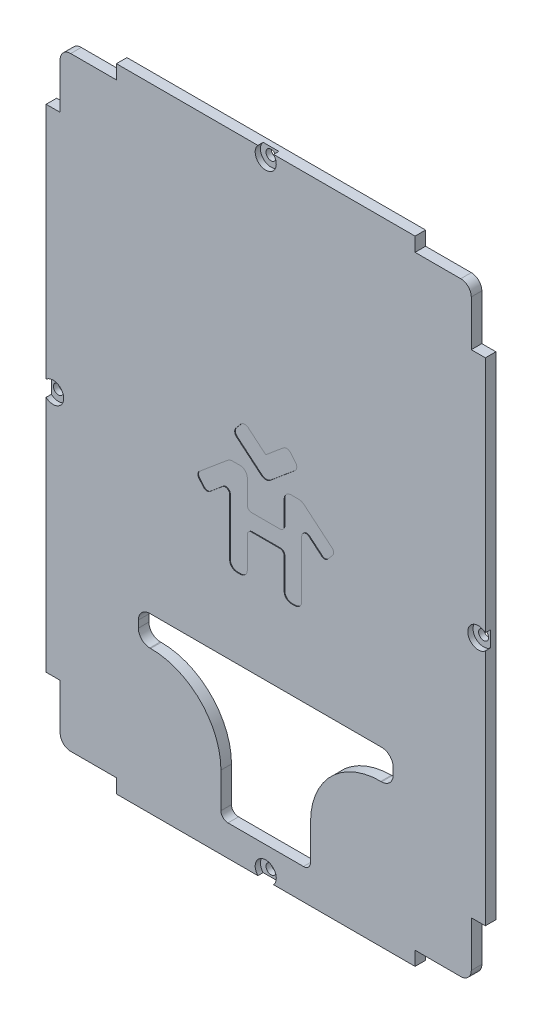
from build123d import *

# Parameters (mm, degrees)
EXTRUDE_1_DEPTH     = 3
CUT_EXTRUDE_1_DEPTH = 10
SKETCH_3_R          = 3
CUT_EXTRUDE_2_DEPTH = 1.5
SKETCH_4_R          = 1.425
CUT_EXTRUDE_3_DEPTH = 2
CUT_EXTRUDE_4_DEPTH = 0.2
CUT_EXTRUDE_START   = -10
CUT_EXTRUDE_5_DEPTH = 10


with BuildPart() as part:
    # Эскиз1 → Бобышка-Вытянуть1 (new body)
    with BuildSketch(Plane.XY):
        with BuildLine():
            Line((-52.5, -90), (52.5, -90))
            ThreePointArc((52.5, -90), (59.571067812, -87.071067812), (62.5, -80))
            Line((62.5, -80), (62.5, 80))
            ThreePointArc((62.5, 80), (59.571067812, 87.071067812), (52.5, 90))
            Line((52.5, 90), (-52.5, 90))
            ThreePointArc((-52.5, 90), (-59.571067812, 87.071067812), (-62.5, 80))
            Line((-62.5, 80), (-62.5, -80))
            ThreePointArc((-62.5, -80), (-59.571067812, -87.071067812), (-52.5, -90))
        make_face()
    extrude(amount=EXTRUDE_1_DEPTH)

    # Эскиз2 → Вырез-Вытянуть1 (cut)
    with BuildSketch(Plane(origin=(0, 0, 0), x_dir=(-1, 0, 0), z_dir=(0, 0, -1))):
        with BuildLine():
            Line((-36.25, -44), (-36.25, -46))
            ThreePointArc((-36.25, -46), (-35.298097039, -48.298097039), (-33, -49.25))
            Line((-33, -49.25), (-32.75, -49.25))
            ThreePointArc((-32.75, -49.25), (-18.607864376, -55.107864376), (-12.75, -69.25))
            Line((-12.75, -69.25), (-12.75, -79.25))
            ThreePointArc((-12.75, -79.25), (-12.164213562, -80.664213562), (-10.75, -81.25))
            Line((-10.75, -81.25), (10.75, -81.25))
            ThreePointArc((10.75, -81.25), (12.164213562, -80.664213562), (12.75, -79.25))
            Line((12.75, -79.25), (12.75, -69.25))
            ThreePointArc((12.75, -69.25), (18.607864376, -55.107864376), (32.75, -49.25))
            Line((32.75, -49.25), (33, -49.25))
            ThreePointArc((33, -49.25), (35.298097039, -48.298097039), (36.25, -46))
            Line((36.25, -46), (36.25, -44))
            ThreePointArc((36.25, -44), (35.298097039, -41.701902961), (33, -40.75))
            Line((33, -40.75), (-33, -40.75))
            ThreePointArc((-33, -40.75), (-35.298097039, -41.701902961), (-36.25, -44))
        make_face()
    extrude(amount=-CUT_EXTRUDE_1_DEPTH, mode=Mode.SUBTRACT)

    # Эскиз3 → Вырез-Вытянуть2 (cut)
    with BuildSketch(Plane.XY.offset(3)):
        with Locations((0, 88)):
            Circle(SKETCH_3_R)
        with Locations((60.5, 0)):
            Circle(SKETCH_3_R)
        with Locations((0, -88)):
            Circle(SKETCH_3_R)
        with Locations((-60.5, 0)):
            Circle(SKETCH_3_R)
    extrude(amount=-CUT_EXTRUDE_2_DEPTH, mode=Mode.SUBTRACT)

    # Эскиз4 → Вырез-Вытянуть3 (cut)
    with BuildSketch(Plane.XY.offset(1.5)):
        with Locations((0, 88)):
            Circle(SKETCH_4_R)
        with Locations((60.5, 0)):
            Circle(SKETCH_4_R)
        with Locations((0, -88)):
            Circle(SKETCH_4_R)
        with Locations((-60.5, 0)):
            Circle(SKETCH_4_R)
    extrude(amount=-CUT_EXTRUDE_3_DEPTH, mode=Mode.SUBTRACT)

    # Эскиз5 → Вырез-Вытянуть4 (cut)
    with BuildSketch(Plane.XY.offset(3)):
        with BuildLine():
            Line((-10.25, -0.09106889), (-10.25, -16.21851864))
            ThreePointArc((-10.25, -16.21851864), (-9.664213562, -17.632732202), (-8.25, -18.21851864))
            Line((-8.25, -18.21851864), (-7.25, -18.21851864))
            ThreePointArc((-7.25, -18.21851864), (-5.835786438, -17.632732202), (-5.25, -16.21851864))
            Line((-5.25, -16.21851864), (-5.25, -7.46851864))
            ThreePointArc((-5.25, -7.46851864), (-4.883883476, -6.584635164), (-4, -6.21851864))
            Line((-4, -6.21851864), (4, -6.21851864))
            ThreePointArc((4, -6.21851864), (4.883883476, -6.584635164), (5.25, -7.46851864))
            Line((5.25, -7.46851864), (5.25, -16.21851864))
            ThreePointArc((5.25, -16.21851864), (5.835786438, -17.632732202), (7.25, -18.21851864))
            Line((7.25, -18.21851864), (8.25, -18.21851864))
            ThreePointArc((8.25, -18.21851864), (9.664213562, -17.632732202), (10.25, -16.21851864))
            Line((10.25, -16.21851864), (10.25, -0.09106889))
            ThreePointArc((10.25, -0.09106889), (10.971727173, 1.041815844), (12.303484512, 0.866486664))
            Line((12.303484512, 0.866486664), (15.917557024, -2.166080248))
            ThreePointArc((15.917557024, -2.166080248), (16.829986215, -2.453768066), (17.67859709, -2.012009206))
            Line((17.67859709, -2.012009206), (19.022071027, -0.410919315))
            ThreePointArc((19.022071027, -0.410919315), (19.309758846, 0.501509876), (18.867999985, 1.350120751))
            Line((18.867999985, 1.350120751), (10.947043439, 7.996592468))
            ThreePointArc((10.947043439, 7.996592468), (10.195124773, 8.430712912), (9.340074414, 8.58148136))
            Line((9.340074414, 8.58148136), (7.25, 8.58148136))
            ThreePointArc((7.25, 8.58148136), (5.835786438, 7.995694922), (5.25, 6.58148136))
            Line((5.25, 6.58148136), (5.25, -0.16851864))
            ThreePointArc((5.25, -0.16851864), (4.883883476, -1.052402116), (4, -1.41851864))
            Line((4, -1.41851864), (-4, -1.41851864))
            ThreePointArc((-4, -1.41851864), (-4.883883476, -1.052402116), (-5.25, -0.16851864))
            Line((-5.25, -0.16851864), (-5.25, 6.58148136))
            ThreePointArc((-5.25, 6.58148136), (-5.835786438, 7.995694922), (-7.25, 8.58148136))
            Line((-7.25, 8.58148136), (-9.340074414, 8.58148136))
            ThreePointArc((-9.340074414, 8.58148136), (-10.195124773, 8.430712912), (-10.947043439, 7.996592468))
            Line((-10.947043439, 7.996592468), (-18.867999985, 1.350120751))
            ThreePointArc((-18.867999985, 1.350120751), (-19.309758846, 0.501509876), (-19.022071027, -0.410919315))
            Line((-19.022071027, -0.410919315), (-17.67859709, -2.012009206))
            ThreePointArc((-17.67859709, -2.012009206), (-16.829986215, -2.453768066), (-15.917557024, -2.166080248))
            Line((-15.917557024, -2.166080248), (-12.303484512, 0.866486664))
            ThreePointArc((-12.303484512, 0.866486664), (-10.971727173, 1.041815844), (-10.25, -0.09106889))
        make_face()
        with BuildLine():
            Line((0, 14.858517807), (-4.979473915, 19.036792532))
            ThreePointArc((-4.979473915, 19.036792532), (-6.074388944, 19.382017915), (-7.092721994, 18.851907282))
            Line((-7.092721994, 18.851907282), (-8.483871936, 17.193999341))
            ThreePointArc((-8.483871936, 17.193999341), (-8.829097318, 16.099084312), (-8.298986686, 15.080751262))
            Line((-8.298986686, 15.080751262), (-1.285575219, 9.195800287))
            ThreePointArc((-1.285575219, 9.195800287), (0, 8.727889173), (1.285575219, 9.195800287))
            Line((1.285575219, 9.195800287), (8.298986686, 15.080751262))
            ThreePointArc((8.298986686, 15.080751262), (8.829097318, 16.099084312), (8.483871936, 17.193999341))
            Line((8.483871936, 17.193999341), (7.092721994, 18.851907282))
            ThreePointArc((7.092721994, 18.851907282), (6.074388944, 19.382017915), (4.979473915, 19.036792532))
            Line((4.979473915, 19.036792532), (0, 14.858517807))
        make_face()
    extrude(amount=-CUT_EXTRUDE_4_DEPTH, mode=Mode.SUBTRACT)

    # Эскиз8 → Вырез-Вытянуть5 (cut)
    with BuildSketch(Plane.XY.offset(3).offset(CUT_EXTRUDE_START)):
        with BuildLine():
            Line((-52.5, 90), (-42.5, 90))
            Line((-42.5, 90), (-42.5, 86))
            Line((-42.5, 86), (-55.5, 86))
            ThreePointArc((-55.5, 86), (-57.621320344, 85.121320344), (-58.5, 83))
            Line((-58.5, 83), (-58.5, 70))
            Line((-58.5, 70), (-62.5, 70))
            Line((-62.5, 70), (-62.5, 80))
            ThreePointArc((-62.5, 80), (-59.571067812, 87.071067812), (-52.5, 90))
        make_face()
        with BuildLine():
            Line((62.5, 70), (62.5, 80))
            ThreePointArc((62.5, 80), (59.571067812, 87.071067812), (52.5, 90))
            Line((52.5, 90), (42.5, 90))
            Line((42.5, 90), (42.5, 86))
            Line((42.5, 86), (55.5, 86))
            ThreePointArc((55.5, 86), (57.621320344, 85.121320344), (58.5, 83))
            Line((58.5, 83), (58.5, 70))
            Line((58.5, 70), (62.5, 70))
        make_face()
        with BuildLine():
            Line((52.5, -90), (42.5, -90))
            Line((42.5, -90), (42.5, -86))
            Line((42.5, -86), (55.5, -86))
            ThreePointArc((55.5, -86), (57.621320344, -85.121320344), (58.5, -83))
            Line((58.5, -83), (58.5, -70))
            Line((58.5, -70), (62.5, -70))
            Line((62.5, -70), (62.5, -80))
            ThreePointArc((62.5, -80), (59.571067812, -87.071067812), (52.5, -90))
        make_face()
        with BuildLine():
            Line((-62.5, -70), (-62.5, -80))
            ThreePointArc((-62.5, -80), (-59.571067812, -87.071067812), (-52.5, -90))
            Line((-52.5, -90), (-42.5, -90))
            Line((-42.5, -90), (-42.5, -86))
            Line((-42.5, -86), (-55.5, -86))
            ThreePointArc((-55.5, -86), (-57.621320344, -85.121320344), (-58.5, -83))
            Line((-58.5, -83), (-58.5, -70))
            Line((-58.5, -70), (-62.5, -70))
        make_face()
    extrude(amount=CUT_EXTRUDE_5_DEPTH, mode=Mode.SUBTRACT)


solid = part.part
